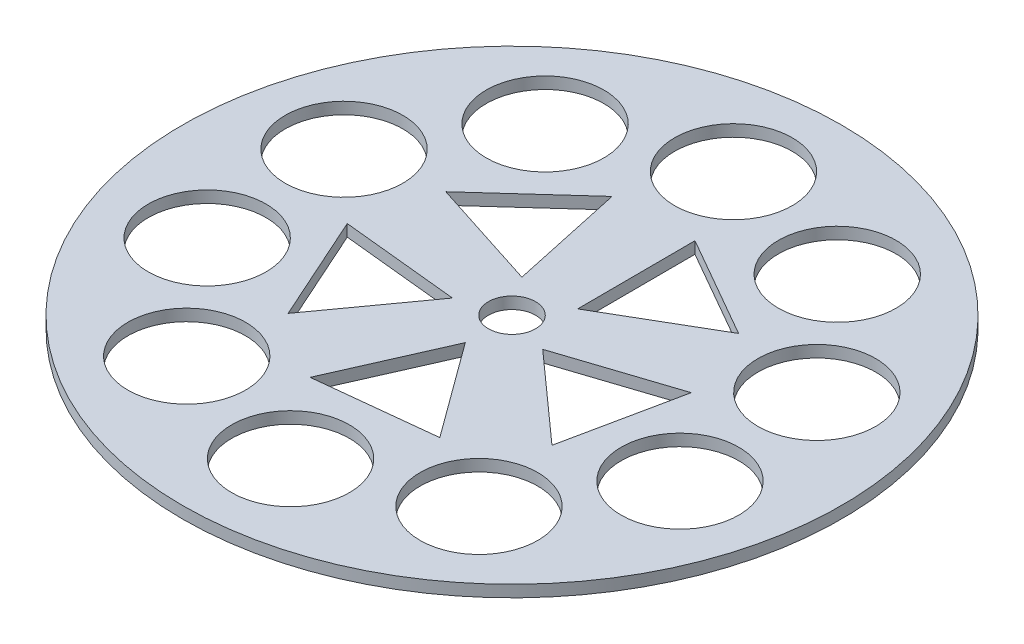
from build123d import *

# Parameters (mm, degrees)
SKETCH1_R           = 177.8
SKETCH1_R_2         = 31.75
SKETCH1_R_3         = 12.7
BOSS_EXTRUDE1_DEPTH = 6.35


with BuildPart() as part:
    # Sketch1 → Boss-Extrude1 (new body)
    with BuildSketch(Plane(origin=(0, 0, 0), x_dir=(1, 0, 0), z_dir=(0, 1, 0))):
        with Locations(Location((0, 0, 0), (0, 0, 270))):
            Circle(SKETCH1_R)
        with Locations(Location((-80.441860309, 98.275668962, 0), (0, 0, 270))):
            Circle(SKETCH1_R_2, mode=Mode.SUBTRACT)
        with Locations(Location((-7.313843174, 126.789225481, 0), (0, 0, 270))):
            Circle(SKETCH1_R_2, mode=Mode.SUBTRACT)
        with Locations(Location((68.607813465, 106.873607273, 0), (0, 0, 270))):
            Circle(SKETCH1_R_2, mode=Mode.SUBTRACT)
        with Locations(Location((118.323617255, 46.135903587, 0), (0, 0, 270))):
            Circle(SKETCH1_R_2, mode=Mode.SUBTRACT)
        with Locations(Location((122.843820924, -32.224147168, 0), (0, 0, 270))):
            Circle(SKETCH1_R_2, mode=Mode.SUBTRACT)
        with Locations(Location((80.441860309, -98.275668962, 0), (0, 0, 270))):
            Circle(SKETCH1_R_2, mode=Mode.SUBTRACT)
        with Locations(Location((7.313843174, -126.789225481, 0), (0, 0, 270))):
            Circle(SKETCH1_R_2, mode=Mode.SUBTRACT)
        with Locations(Location((-68.607813465, -106.873607273, 0), (0, 0, 270))):
            Circle(SKETCH1_R_2, mode=Mode.SUBTRACT)
        with Locations(Location((-118.323617255, -46.135903587, 0), (0, 0, 270))):
            Circle(SKETCH1_R_2, mode=Mode.SUBTRACT)
        with Locations(Location((-122.843820924, 32.224147168, 0), (0, 0, 270))):
            Circle(SKETCH1_R_2, mode=Mode.SUBTRACT)
        with Locations(Location((0, 0, 0), (0, 0, 270))):
            Circle(SKETCH1_R_3, mode=Mode.SUBTRACT)
        Polygon((84.545380805, 12.171415864), (24.219453502, -7.6536313), (71.551411628, -49.984893269), align=None, mode=Mode.SUBTRACT)
        Polygon((14.550255095, 84.168609684), (14.763258648, 20.668966934), (69.649060625, 52.603254797), align=None, mode=Mode.SUBTRACT)
        Polygon((37.701663834, -76.646260989), (0.205186805, -25.399171214), (-25.427856295, -83.495617761), align=None, mode=Mode.SUBTRACT)
        Polygon((-61.244471123, -59.541410266), (-24.092641082, -8.043919797), (-87.26669108, -1.618236419), align=None, mode=Mode.SUBTRACT)
        Polygon((-75.552828611, 39.847645707), (-15.095257873, 20.427755377), (-28.505924878, 82.495492653), align=None, mode=Mode.SUBTRACT)
    extrude(amount=BOSS_EXTRUDE1_DEPTH)


solid = part.part
